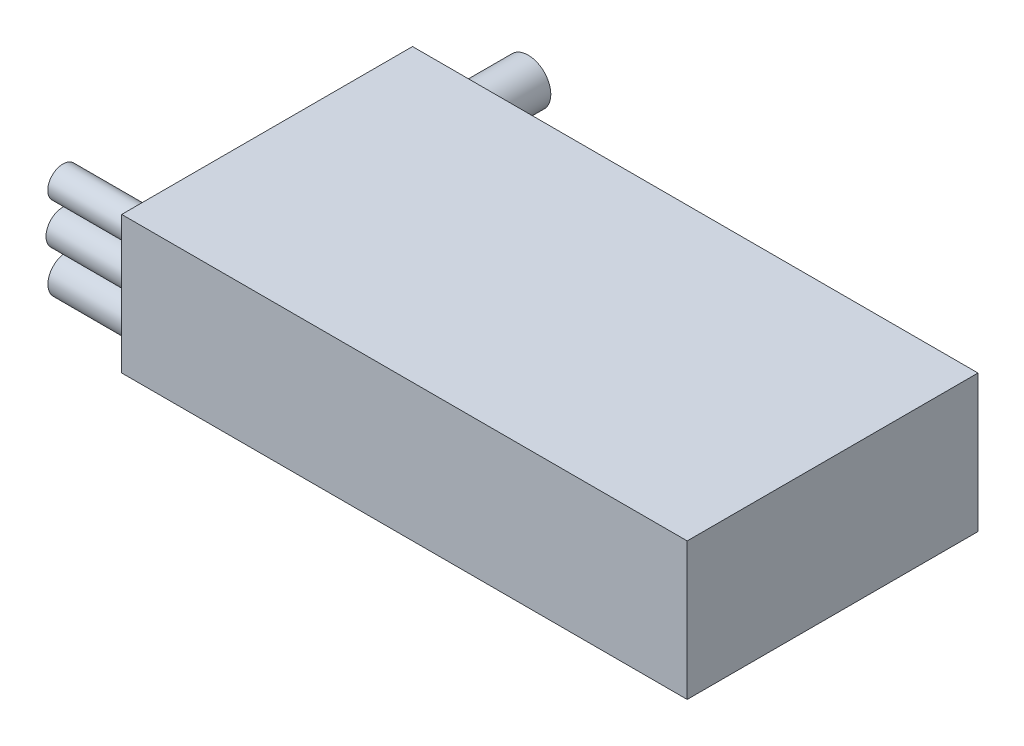
from build123d import *

# Parameters (mm, degrees)
SKETCH3_W           = 70
SKETCH3_H           = 36
BOSS_EXTRUDE2_DEPTH = 17
SKETCH4_R           = 1.880557467
SKETCH4_R_2         = 2.098035393
SKETCH4_R_3         = 2.319039591
BOSS_EXTRUDE3_DEPTH = 10
SKETCH5_R           = 2.614216035
SKETCH5_R_2         = 2.802234852
BOSS_EXTRUDE4_DEPTH = 10


with BuildPart() as part:
    # Sketch3 → Boss-Extrude2 (new body)
    with BuildSketch(Plane(origin=(0, 0, 0), x_dir=(1, 0, 0), z_dir=(0, 1, 0))):
        Rectangle(SKETCH3_W, SKETCH3_H)
    extrude(amount=BOSS_EXTRUDE2_DEPTH)

    # Sketch4 → Boss-Extrude3 (add)
    with BuildSketch(Plane.ZY.offset(35)):
        with Locations(Location((15.274859304, 14.166430081, 0), (0, 0, 180))):
            Circle(SKETCH4_R)
        with Locations(Location((15.274859304, 9.332242636, 0), (0, 0, 180))):
            Circle(SKETCH4_R_2)
        with Locations(Location((14.82177003, 4.074871994, 0), (0, 0, 180))):
            Circle(SKETCH4_R_3)
    extrude(amount=BOSS_EXTRUDE3_DEPTH)

    # Sketch5 → Boss-Extrude4 (add)
    with BuildSketch(Plane(origin=(0, 0, -18), x_dir=(-1, 0, 0), z_dir=(0, 0, -1))):
        with Locations(Location((31.106031622, 3.885850759, 0), (0, 0, 180))):
            Circle(SKETCH5_R)
        with Locations(Location((30.683181336, 10.433921975, 0), (0, 0, 180))):
            Circle(SKETCH5_R_2)
    extrude(amount=BOSS_EXTRUDE4_DEPTH)


solid = part.part
